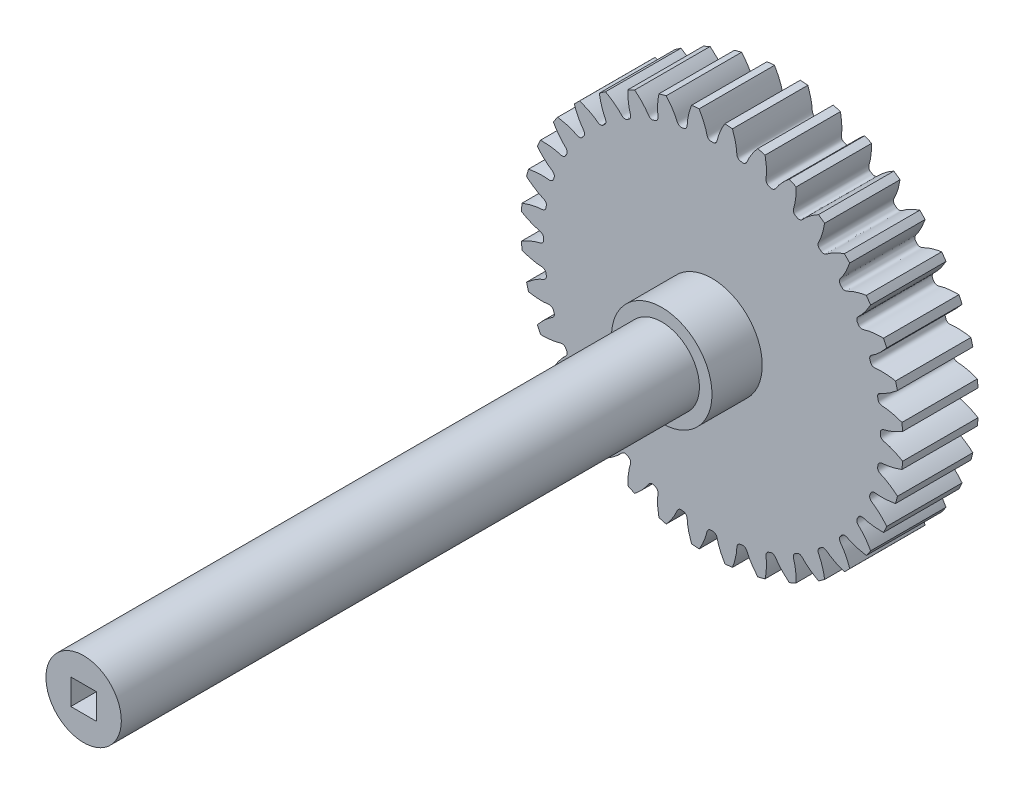
from build123d import *

# Parameters (mm, degrees)
SKETCH_313_W               = 15
SKETCH_313_H               = 37.999999429
CUT_EXTRUDE_506_DEPTH      = 7.5
PATTERN_CIRCULAR_556_COUNT = 36
SKETCH5_R                  = 10
EXTRUDE2_DEPTH             = 10
SKETCH6_R                  = 7.5
EXTRUDE3_DEPTH             = 115
SKETCH7_W                  = 5.1
SKETCH7_H                  = 5.1
EXTRUDE5_DEPTH             = 8


with BuildPart() as part:
    # Sketch 313 → Revolve 376 (revolve)
    with BuildSketch(Plane(origin=(0, 0, 0), x_dir=(0, 0, -1), z_dir=(1, 0, 0))):
        with Locations((0, 18.999999714)):
            Rectangle(SKETCH_313_W, SKETCH_313_H)
    revolve(axis=Axis((0, 0, 0), (0, 0, -1)))

    # Sketch 417 → Cut-Extrude 506 (cut, symmetric)
    with BuildSketch(Plane.XY):
        with BuildLine():
            ThreePointArc((38.009834509, 2.619625355), (38.099999428, 0), (38.009834509, -2.619625355))
            add(Edge.make_bspline(
                [(38.009834509, -2.619625355), (37.813774889, -2.5002728), (37.522284048, -2.330555137), (37.135098232, -2.12106692), (36.860427097, -1.979635077), (36.595631751, -1.850065164), (36.341077136, -1.731891674), (36.097113256, -1.624639008), (35.86407482, -1.527822446), (35.642281352, -1.440947286), (35.432035793, -1.363513536), (35.23362826, -1.295001862), (35.047322414, -1.234923033), (34.87340035, -1.182653807), (34.712012238, -1.137985567), (34.498104784, -1.082223169), (34.315557709, -1.047510692), (34.168027901, -1.002139811), (34.111269076, -0.982449348), (34.055478158, -0.960609225), (34.000382048, -0.936246478), (33.945674751, -0.908841034), (33.89103964, -0.877683232), (33.836189957, -0.841809945), (33.780954122, -0.799936463), (33.725433326, -0.750402955), (33.670264552, -0.691190677), (33.616999745, -0.620119084), (33.568499338, -0.535368577), (33.529096834, -0.436471771), (33.505077765, -0.330702778), (33.495449484, -0.18361633), (33.503118339, 0), (33.495449484, 0.18361633), (33.505077765, 0.330702778), (33.529096834, 0.436471771), (33.568499338, 0.535368577), (33.616999745, 0.620119084), (33.670264552, 0.691190677), (33.725433326, 0.750402955), (33.780954122, 0.799936463), (33.836189957, 0.841809945), (33.89103964, 0.877683232), (33.945674751, 0.908841034), (34.000382048, 0.936246478), (34.055478158, 0.960609225), (34.111269076, 0.982449348), (34.168027901, 1.002139811), (34.315557709, 1.047510692), (34.498104784, 1.082223169), (34.712012238, 1.137985567), (34.87340035, 1.182653807), (35.047322414, 1.234923033), (35.23362826, 1.295001862), (35.432035793, 1.363513536), (35.642281352, 1.440947286), (35.86407482, 1.527822446), (36.097113256, 1.624639008), (36.341077136, 1.731891674), (36.595631751, 1.850065164), (36.860427097, 1.979635077), (37.135098232, 2.12106692), (37.522284048, 2.330555137), (37.813774889, 2.5002728), (38.009834509, 2.619625355)],
                knots=[0, 0, 0, 0, 0.062457111, 0.091760772, 0.11978117, 0.146518305, 0.171972177, 0.196142787, 0.219030134, 0.240634218, 0.260955039, 0.279992597, 0.297746893, 0.314217925, 0.329405695, 0.343310202, 0.374368983, 0.379859239, 0.385295478, 0.390713489, 0.396157511, 0.401682397, 0.407356152, 0.413262644, 0.419503807, 0.426199859, 0.433484463, 0.441489759, 0.450315042, 0.459977093, 0.470355566, 0.479679992, 0.5, 0.520320008, 0.529644434, 0.540022907, 0.549684958, 0.558510241, 0.566515537, 0.573800141, 0.580496193, 0.586737356, 0.592643848, 0.598317603, 0.603842489, 0.609286511, 0.614704522, 0.620140761, 0.625631017, 0.656689798, 0.670594305, 0.685782075, 0.702253107, 0.720007403, 0.739044961, 0.759365782, 0.780969866, 0.803857213, 0.828027823, 0.853481695, 0.88021883, 0.908239228, 0.937542889, 1, 1, 1, 1], degree=3))
        make_face()
    cut_extrude_506 = extrude(amount=CUT_EXTRUDE_506_DEPTH, both=True, mode=Mode.SUBTRACT)

    # Pattern Circular 556: Cut-Extrude 506 ×36 about axis
    pattern_circular_556_axis = Axis((0, 0, 55), (0, 0, -1))
    for i in range(1, PATTERN_CIRCULAR_556_COUNT):
        add(cut_extrude_506.rotate(pattern_circular_556_axis, i * 360 / PATTERN_CIRCULAR_556_COUNT), mode=Mode.SUBTRACT)

    # Sketch5 → Extrude2 (add)
    with BuildSketch(Plane.XY.offset(7.5)):
        Circle(SKETCH5_R)
    extrude(amount=EXTRUDE2_DEPTH)

    # Sketch6 → Extrude3 (add)
    with BuildSketch(Plane.XY.offset(17.5)):
        Circle(SKETCH6_R)
    extrude(amount=EXTRUDE3_DEPTH)

    # Sketch7 → Extrude5 (cut)
    with BuildSketch(Plane.XY.offset(132.5)):
        Rectangle(SKETCH7_W, SKETCH7_H)
    extrude(amount=-EXTRUDE5_DEPTH, mode=Mode.SUBTRACT)


solid = part.part
